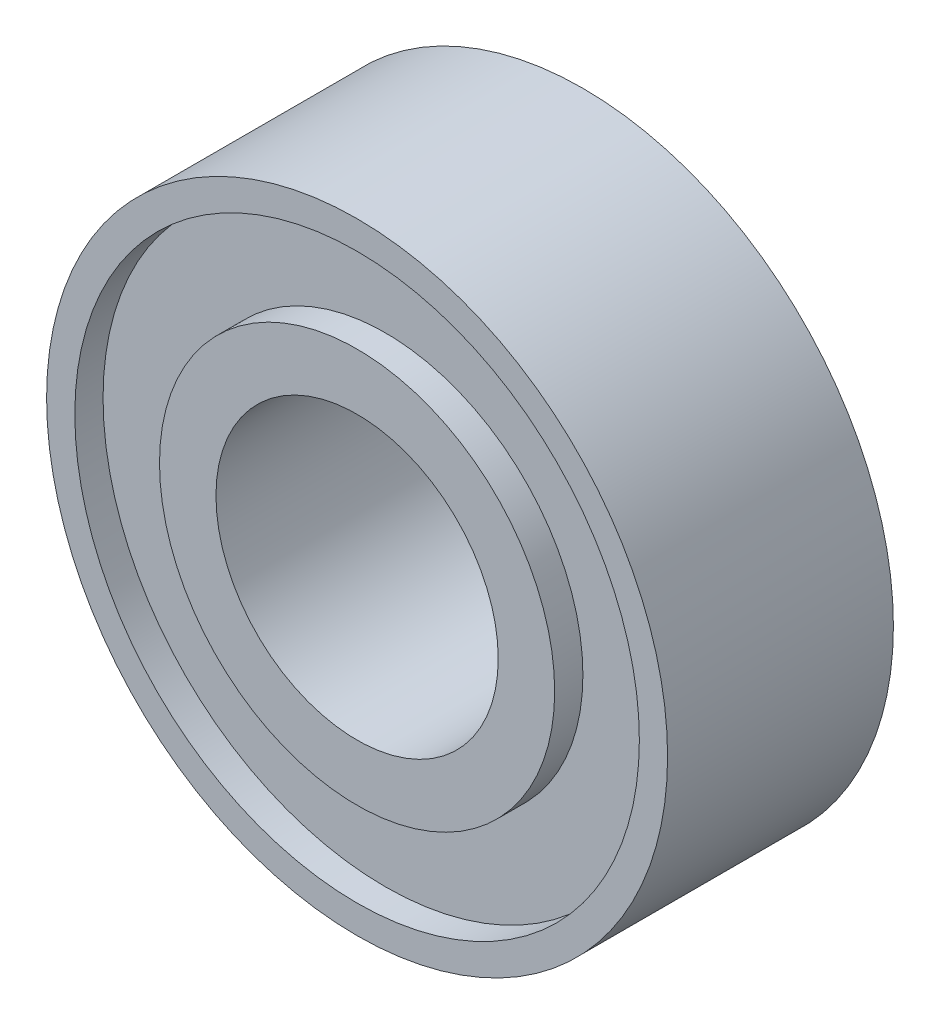
from build123d import *

# Parameters (mm, degrees)
SKETCH2_R           = 5.5
SKETCH2_R_2         = 2.5
BOSS_EXTRUDE1_DEPTH = 2
SKETCH4_R           = 5
SKETCH4_R_2         = 3.5
CUT_EXTRUDE1_DEPTH  = 0.5


with BuildPart() as part:
    # Sketch2 → Boss-Extrude1 (new body)
    with BuildSketch(Plane.XY):
        with Locations((5.726371269, 6.63304672)):
            Circle(SKETCH2_R)
        with Locations((5.726371269, 6.63304672)):
            Circle(SKETCH2_R_2, mode=Mode.SUBTRACT)
    boss_extrude1 = extrude(amount=BOSS_EXTRUDE1_DEPTH)

    # Sketch4 → Cut-Extrude1 (cut)
    with BuildSketch(Plane.XY.offset(2)):
        with Locations((5.726371269, 6.63304672)):
            Circle(SKETCH4_R)
        with Locations((5.726371269, 6.63304672)):
            Circle(SKETCH4_R_2, mode=Mode.SUBTRACT)
    cut_extrude1 = extrude(amount=-CUT_EXTRUDE1_DEPTH, mode=Mode.SUBTRACT)

    # Mirror2: Boss-Extrude1, Cut-Extrude1 across plane
    add(boss_extrude1.mirror(Plane(origin=(5.726371269, 6.63304672, 0), x_dir=(1, 0, 0), z_dir=(0, 0, 1))))
    add(cut_extrude1.mirror(Plane(origin=(5.726371269, 6.63304672, 0), x_dir=(1, 0, 0), z_dir=(0, 0, 1))), mode=Mode.SUBTRACT)


solid = part.part
